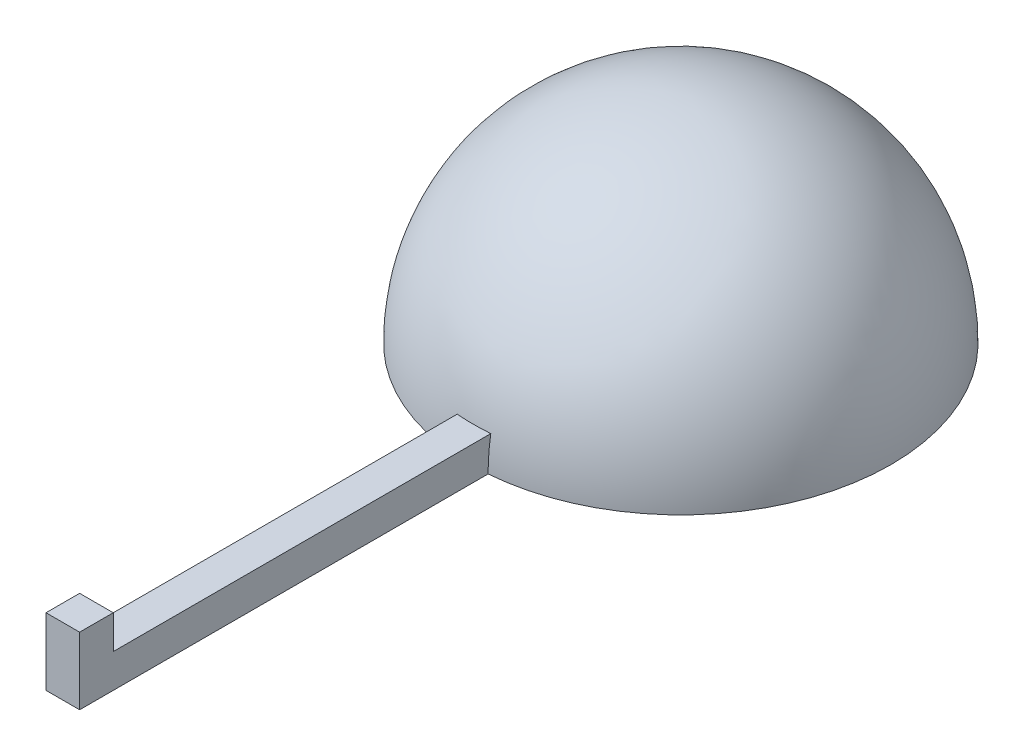
from build123d import *

# Parameters (mm, degrees)
REVOLVE1_ANGLE      = 180
SHELL3_T            = -3
BOSS_EXTRUDE1_DEPTH = 4


with BuildPart() as part:
    # Sketch1 → Revolve1 (revolve)
    with BuildSketch(Plane(origin=(0, 0, 0), x_dir=(1, 0, 0), z_dir=(0, 1, 0))):
        with BuildLine():
            Line((-50, 0), (50, 0))
            ThreePointArc((50, 0), (0, 50), (-50, 0))
        make_face()
    revolve(axis=Axis((-50, 0, 0), (1, 0, 0)), revolution_arc=REVOLVE1_ANGLE)

    # Shell3
    shell3_openings = [part.faces().sort_by_distance(p)[0] for p in [
        (0, 0, 0),
    ]]
    offset(amount=SHELL3_T, openings=shell3_openings)

    # Sketch5 → Boss-Extrude1 (add, symmetric)
    with BuildSketch(Plane(origin=(0, 0, 0), x_dir=(0, 0, -1), z_dir=(1, 0, 0))):
        Polygon((-47, 0), (-47, 8), (-139, 8), (-139, 16), (-147, 16), (-147, 0), align=None)
    extrude(amount=BOSS_EXTRUDE1_DEPTH, both=True)


solid = part.part
